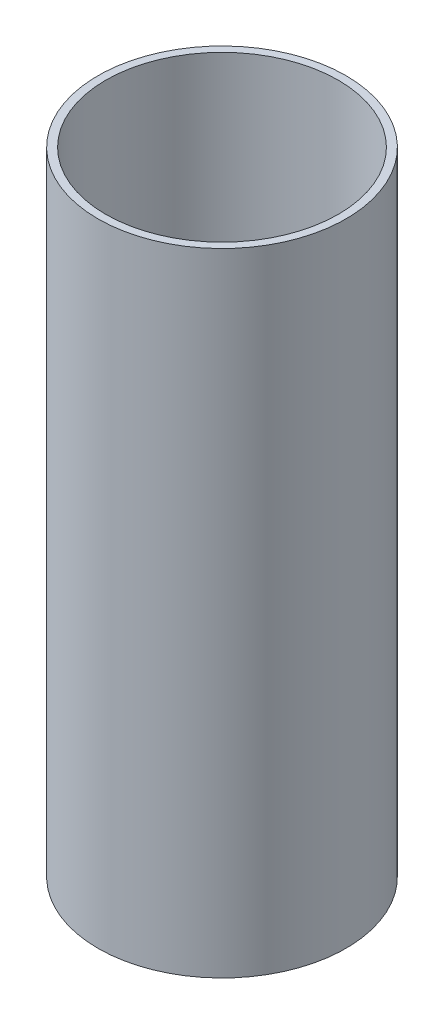
from build123d import *

# Parameters (mm, degrees)
SKETCH1_R           = 39.897090419
SKETCH1_R_2         = 37.397090419
BOSS_EXTRUDE1_DEPTH = 203.2


with BuildPart() as part:
    # Sketch1 → Boss-Extrude1 (new body)
    with BuildSketch(Plane(origin=(0, 0, 0), x_dir=(1, 0, 0), z_dir=(0, 1, 0))):
        with Locations(Location((0, 0, 0), (0, 0, 270))):
            Circle(SKETCH1_R)
        with Locations(Location((0, 0, 0), (0, 0, 270))):
            Circle(SKETCH1_R_2, mode=Mode.SUBTRACT)
    extrude(amount=BOSS_EXTRUDE1_DEPTH)


solid = part.part
